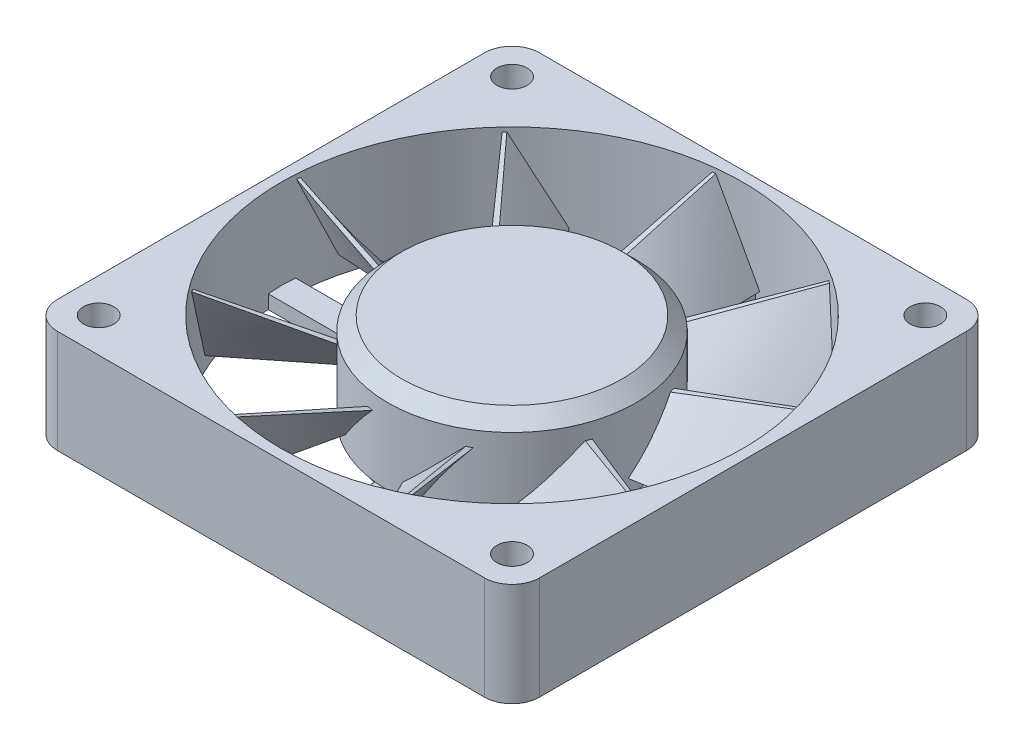
from build123d import *

# Parameters (mm, degrees)
SKETCH1_R           = 33.5
SKETCH1_R_2         = 2.2
BOSS_EXTRUDE1_DEPTH = 15
BOSS_EXTRUDE2_DEPTH = 2
SKETCH3_R           = 18
BOSS_EXTRUDE3_DEPTH = 13
CHAMFER1_SIZE       = 2
CIRPATTERN33_COUNT  = 9


with BuildPart() as part:
    # Sketch1 → Boss-Extrude1 (new body)
    with BuildSketch(Plane(origin=(0, 0, 0), x_dir=(1, 0, 0), z_dir=(0, 1, 0))):
        with BuildLine():
            Line((-31, 35), (31, 35))
            ThreePointArc((31, 35), (33.828427125, 33.828427125), (35, 31))
            Line((35, 31), (35, -31))
            ThreePointArc((35, -31), (33.828427125, -33.828427125), (31, -35))
            Line((31, -35), (-31, -35))
            ThreePointArc((-31, -35), (-33.828427125, -33.828427125), (-35, -31))
            Line((-35, -31), (-35, 31))
            ThreePointArc((-35, 31), (-33.828427125, 33.828427125), (-31, 35))
        make_face()
        with Locations(Location((0, 0, 0), (0, 0, 270))):
            Circle(SKETCH1_R, mode=Mode.SUBTRACT)
        with Locations(Location((-30, 30, 0), (0, 0, 270))):
            Circle(SKETCH1_R_2, mode=Mode.SUBTRACT)
        with Locations(Location((30, 30, 0), (0, 0, 270))):
            Circle(SKETCH1_R_2, mode=Mode.SUBTRACT)
        with Locations(Location((30, -30, 0), (0, 0, 270))):
            Circle(SKETCH1_R_2, mode=Mode.SUBTRACT)
        with Locations(Location((-30, -30, 0), (0, 0, 270))):
            Circle(SKETCH1_R_2, mode=Mode.SUBTRACT)
    extrude(amount=BOSS_EXTRUDE1_DEPTH)


with BuildPart() as body_2:
    # Sketch2 → Boss-Extrude2 (new body)
    with BuildSketch(Plane(origin=(0, 0, 0), x_dir=(1, 0, 0), z_dir=(0, 1, 0))):
        with BuildLine():
            Line((-1.985467564, 33.380107404), (0, 33.5))
            Line((0, 33.5), (1.985467564, 33.380107404))
            Line((1.985467564, 33.380107404), (1.985467564, 16.380107404))
            ThreePointArc((1.985467564, 16.380107404), (11.66726189, 11.66726189), (16.380107404, 1.985467564))
            Line((16.380107404, 1.985467564), (33.380107404, 1.985467564))
            Line((33.380107404, 1.985467564), (33.5, 0))
            Line((33.5, 0), (33.380107404, -1.985467564))
            Line((33.380107404, -1.985467564), (16.380107404, -1.985467564))
            ThreePointArc((16.380107404, -1.985467564), (11.66726189, -11.66726189), (1.985467564, -16.380107404))
            Line((1.985467564, -16.380107404), (1.985467564, -33.380107404))
            Line((1.985467564, -33.380107404), (0, -33.5))
            Line((0, -33.5), (-1.985467564, -33.380107404))
            Line((-1.985467564, -33.380107404), (-1.985467564, -16.380107404))
            ThreePointArc((-1.985467564, -16.380107404), (-11.66726189, -11.66726189), (-16.380107404, -1.985467564))
            Line((-16.380107404, -1.985467564), (-33.380107404, -1.985467564))
            Line((-33.380107404, -1.985467564), (-33.5, 0))
            Line((-33.5, 0), (-33.380107404, 1.985467564))
            Line((-33.380107404, 1.985467564), (-16.380107404, 1.985467564))
            ThreePointArc((-16.380107404, 1.985467564), (-11.66726189, 11.66726189), (-1.985467564, 16.380107404))
            Line((-1.985467564, 16.380107404), (-1.985467564, 33.380107404))
        make_face()
    extrude(amount=BOSS_EXTRUDE2_DEPTH)

    # Sketch3 → Boss-Extrude3 (add)
    with BuildSketch(Plane(origin=(0, 2, 0), x_dir=(1, 0, 0), z_dir=(0, 1, 0))):
        with Locations(Location((0, 0, 0), (0, 0, 83.667174079))):
            Circle(SKETCH3_R)
    extrude(amount=BOSS_EXTRUDE3_DEPTH)

    # Chamfer1
    chamfer1_edges = [body_2.edges().sort_by_distance(p)[0] for p in [
        (-1.985467564, 15, 17.890162619),
    ]]
    chamfer(chamfer1_edges, length=CHAMFER1_SIZE)

    # Sketch8 → Loft2 section 0
    with BuildSketch(Plane(origin=(0, 0, -33), x_dir=(-1, 0, 0), z_dir=(0, 0, -1))):
        with BuildLine():
            Line((-2.964308485, 2.962946086), (-1.382716758, 2.962946086))
            Line((-1.382716758, 2.962946086), (3.90507934, 14.59289777))
            Line((3.90507934, 14.59289777), (3.419420465, 14.59289777))
            Line((3.419420465, 14.59289777), (-2.964308485, 2.962946086))
        make_face()
    # Sketch7 → Loft2 section 1
    with BuildSketch(Plane(origin=(0, 0, -17), x_dir=(-1, 0, 0), z_dir=(0, 0, -1))):
        with BuildLine():
            Line((3.003785407, 10.615866262), (3.806080572, 10.615866262))
            Line((3.806080572, 10.615866262), (-2.159284163, 4.051963863))
            Line((-2.159284163, 4.051963863), (-4.236780151, 4.051963863))
            Line((-4.236780151, 4.051963863), (3.003785407, 10.615866262))
        make_face()
    loft2 = loft()

    # CirPattern33: Loft2 ×9 about axis
    cirpattern33_axis = Axis((0, 15, 0), (0, -1, 0))
    for i in range(1, CIRPATTERN33_COUNT):
        add(loft2.rotate(cirpattern33_axis, i * 360 / CIRPATTERN33_COUNT))


solid = Compound([part.part, body_2.part])
